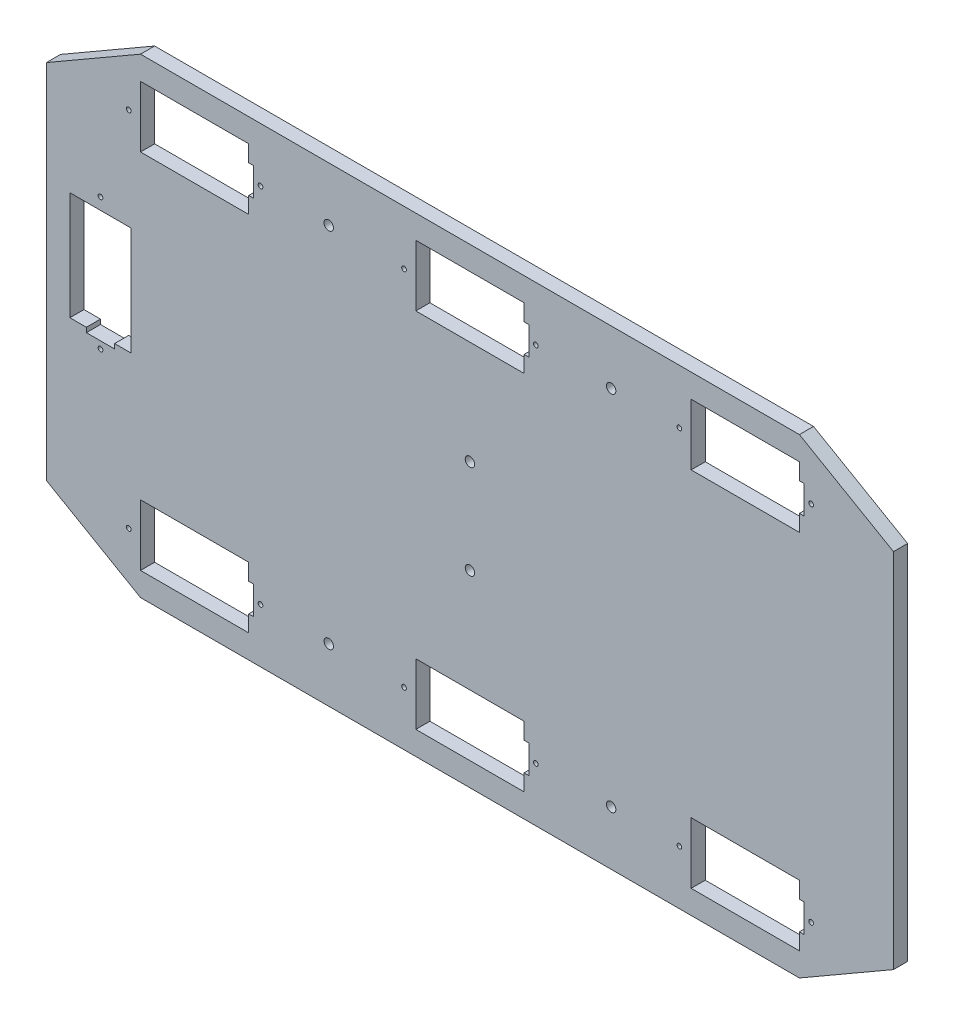
from build123d import *

# Parameters (mm, degrees)
BOSS_EXTRUDE1_DEPTH = 3
CUT_EXTRUDE1_REACH  = 105
SKETCH2_R           = 0.5
SKETCH2_R_2         = 1
CUT_EXTRUDE2_REACH  = 105
SKETCH3_R           = 0.5
CUT_EXTRUDE3_REACH  = 105
SKETCH5_R           = 1


with BuildPart() as part:
    # Sketch1 → Boss-Extrude1 (new body)
    with BuildSketch(Plane.XY):
        Polygon((70, 50), (90, 38.452994616), (90, -38.452994616), (70, -50), (-70, -50), (-90, -38.452994616), (-90, 38.452994616), (-70, 50), align=None)
    extrude(amount=BOSS_EXTRUDE1_DEPTH)

    # Sketch2 → Cut-Extrude1 (cut, up to next)
    with BuildSketch(Plane.XY.offset(3), mode=Mode.PRIVATE) as cut_extrude1_sk1:
        with Locations((-72.5, 38.5)):
            Circle(SKETCH2_R)
    cut_extrude1_tool1 = extrude(cut_extrude1_sk1.sketch, amount=-CUT_EXTRUDE1_REACH, mode=Mode.PRIVATE) & part.part
    # Sketch2 → Cut-Extrude1 (cut, up to next)
    with BuildSketch(Plane.XY.offset(3), mode=Mode.PRIVATE) as cut_extrude1_sk2:
        with Locations((-44.5, 38.5)):
            Circle(SKETCH2_R)
    cut_extrude1_tool2 = extrude(cut_extrude1_sk2.sketch, amount=-CUT_EXTRUDE1_REACH, mode=Mode.PRIVATE) & part.part
    # Sketch2 → Cut-Extrude1 (cut, up to next)
    with BuildSketch(Plane.XY.offset(3), mode=Mode.PRIVATE) as cut_extrude1_sk3:
        with Locations((-14, 38.5)):
            Circle(SKETCH2_R)
    cut_extrude1_tool3 = extrude(cut_extrude1_sk3.sketch, amount=-CUT_EXTRUDE1_REACH, mode=Mode.PRIVATE) & part.part
    # Sketch2 → Cut-Extrude1 (cut, up to next)
    with BuildSketch(Plane.XY.offset(3), mode=Mode.PRIVATE) as cut_extrude1_sk4:
        with Locations((14, 38.5)):
            Circle(SKETCH2_R)
    cut_extrude1_tool4 = extrude(cut_extrude1_sk4.sketch, amount=-CUT_EXTRUDE1_REACH, mode=Mode.PRIVATE) & part.part
    # Sketch2 → Cut-Extrude1 (cut, up to next)
    with BuildSketch(Plane.XY.offset(3), mode=Mode.PRIVATE) as cut_extrude1_sk5:
        with Locations((44.5, 38.5)):
            Circle(SKETCH2_R)
    cut_extrude1_tool5 = extrude(cut_extrude1_sk5.sketch, amount=-CUT_EXTRUDE1_REACH, mode=Mode.PRIVATE) & part.part
    # Sketch2 → Cut-Extrude1 (cut, up to next)
    with BuildSketch(Plane.XY.offset(3), mode=Mode.PRIVATE) as cut_extrude1_sk6:
        with Locations((72.5, 38.5)):
            Circle(SKETCH2_R)
    cut_extrude1_tool6 = extrude(cut_extrude1_sk6.sketch, amount=-CUT_EXTRUDE1_REACH, mode=Mode.PRIVATE) & part.part
    # Sketch2 → Cut-Extrude1 (cut, up to next)
    with BuildSketch(Plane.XY.offset(3), mode=Mode.PRIVATE) as cut_extrude1_sk7:
        with Locations((72.5, -38.5)):
            Circle(SKETCH2_R)
    cut_extrude1_tool7 = extrude(cut_extrude1_sk7.sketch, amount=-CUT_EXTRUDE1_REACH, mode=Mode.PRIVATE) & part.part
    # Sketch2 → Cut-Extrude1 (cut, up to next)
    with BuildSketch(Plane.XY.offset(3), mode=Mode.PRIVATE) as cut_extrude1_sk8:
        with Locations((44.5, -38.5)):
            Circle(SKETCH2_R)
    cut_extrude1_tool8 = extrude(cut_extrude1_sk8.sketch, amount=-CUT_EXTRUDE1_REACH, mode=Mode.PRIVATE) & part.part
    # Sketch2 → Cut-Extrude1 (cut, up to next)
    with BuildSketch(Plane.XY.offset(3), mode=Mode.PRIVATE) as cut_extrude1_sk9:
        with Locations((14, -38.5)):
            Circle(SKETCH2_R)
    cut_extrude1_tool9 = extrude(cut_extrude1_sk9.sketch, amount=-CUT_EXTRUDE1_REACH, mode=Mode.PRIVATE) & part.part
    # Sketch2 → Cut-Extrude1 (cut, up to next)
    with BuildSketch(Plane.XY.offset(3), mode=Mode.PRIVATE) as cut_extrude1_sk10:
        with Locations((-14, -38.5)):
            Circle(SKETCH2_R)
    cut_extrude1_tool10 = extrude(cut_extrude1_sk10.sketch, amount=-CUT_EXTRUDE1_REACH, mode=Mode.PRIVATE) & part.part
    # Sketch2 → Cut-Extrude1 (cut, up to next)
    with BuildSketch(Plane.XY.offset(3), mode=Mode.PRIVATE) as cut_extrude1_sk11:
        with Locations((-44.5, -38.5)):
            Circle(SKETCH2_R)
    cut_extrude1_tool11 = extrude(cut_extrude1_sk11.sketch, amount=-CUT_EXTRUDE1_REACH, mode=Mode.PRIVATE) & part.part
    # Sketch2 → Cut-Extrude1 (cut, up to next)
    with BuildSketch(Plane.XY.offset(3), mode=Mode.PRIVATE) as cut_extrude1_sk12:
        with Locations((-72.5, -38.5)):
            Circle(SKETCH2_R)
    cut_extrude1_tool12 = extrude(cut_extrude1_sk12.sketch, amount=-CUT_EXTRUDE1_REACH, mode=Mode.PRIVATE) & part.part
    # Sketch2 → Cut-Extrude1 (cut, up to next)
    with BuildSketch(Plane.XY.offset(3), mode=Mode.PRIVATE) as cut_extrude1_sk13:
        with Locations((0, 10)):
            Circle(SKETCH2_R_2)
    cut_extrude1_tool13 = extrude(cut_extrude1_sk13.sketch, amount=-CUT_EXTRUDE1_REACH, mode=Mode.PRIVATE) & part.part
    # Sketch2 → Cut-Extrude1 (cut, up to next)
    with BuildSketch(Plane.XY.offset(3), mode=Mode.PRIVATE) as cut_extrude1_sk14:
        with Locations((0, -10)):
            Circle(SKETCH2_R_2)
    cut_extrude1_tool14 = extrude(cut_extrude1_sk14.sketch, amount=-CUT_EXTRUDE1_REACH, mode=Mode.PRIVATE) & part.part
    # Sketch2 → Cut-Extrude1 (cut, up to next)
    with BuildSketch(Plane.XY.offset(3), mode=Mode.PRIVATE) as cut_extrude1_sk15:
        Polygon((-11.5, 45), (11.5, 45), (11.5, 41.5), (12.5, 41.5), (12.5, 35.5), (11.5, 35.5), (11.5, 32), (-11.5, 32), align=None)
    cut_extrude1_tool15 = extrude(cut_extrude1_sk15.sketch, amount=-CUT_EXTRUDE1_REACH, mode=Mode.PRIVATE) & part.part
    # Sketch2 → Cut-Extrude1 (cut, up to next)
    with BuildSketch(Plane.XY.offset(3), mode=Mode.PRIVATE) as cut_extrude1_sk16:
        Polygon((-11.5, -32), (11.5, -32), (11.5, -35.5), (12.5, -35.5), (12.5, -41.5), (11.5, -41.5), (11.5, -45), (-11.5, -45), align=None)
    cut_extrude1_tool16 = extrude(cut_extrude1_sk16.sketch, amount=-CUT_EXTRUDE1_REACH, mode=Mode.PRIVATE) & part.part
    # Sketch2 → Cut-Extrude1 (cut, up to next)
    with BuildSketch(Plane.XY.offset(3), mode=Mode.PRIVATE) as cut_extrude1_sk17:
        Polygon((-70, 45), (-47, 45), (-47, 41.5), (-46, 41.5), (-46, 35.5), (-47, 35.5), (-47, 32), (-70, 32), align=None)
    cut_extrude1_tool17 = extrude(cut_extrude1_sk17.sketch, amount=-CUT_EXTRUDE1_REACH, mode=Mode.PRIVATE) & part.part
    # Sketch2 → Cut-Extrude1 (cut, up to next)
    with BuildSketch(Plane.XY.offset(3), mode=Mode.PRIVATE) as cut_extrude1_sk18:
        Polygon((-70, -32), (-47, -32), (-47, -35.5), (-46, -35.5), (-46, -41.5), (-47, -41.5), (-47, -45), (-70, -45), align=None)
    cut_extrude1_tool18 = extrude(cut_extrude1_sk18.sketch, amount=-CUT_EXTRUDE1_REACH, mode=Mode.PRIVATE) & part.part
    # Sketch2 → Cut-Extrude1 (cut, up to next)
    with BuildSketch(Plane.XY.offset(3), mode=Mode.PRIVATE) as cut_extrude1_sk19:
        Polygon((70, -32), (47, -32), (47, -45), (70, -45), (70, -41.5), (71, -41.5), (71, -35.5), (70, -35.5), align=None)
    cut_extrude1_tool19 = extrude(cut_extrude1_sk19.sketch, amount=-CUT_EXTRUDE1_REACH, mode=Mode.PRIVATE) & part.part
    # Sketch2 → Cut-Extrude1 (cut, up to next)
    with BuildSketch(Plane.XY.offset(3), mode=Mode.PRIVATE) as cut_extrude1_sk20:
        Polygon((70, 45), (47, 45), (47, 32), (70, 32), (70, 35.5), (71, 35.5), (71, 41.5), (70, 41.5), align=None)
    cut_extrude1_tool20 = extrude(cut_extrude1_sk20.sketch, amount=-CUT_EXTRUDE1_REACH, mode=Mode.PRIVATE) & part.part
    add(cut_extrude1_tool1.solids().sort_by_distance((-72.5, 38.5, 3))[0], mode=Mode.SUBTRACT)
    add(cut_extrude1_tool2.solids().sort_by_distance((-44.5, 38.5, 3))[0], mode=Mode.SUBTRACT)
    add(cut_extrude1_tool3.solids().sort_by_distance((-14, 38.5, 3))[0], mode=Mode.SUBTRACT)
    add(cut_extrude1_tool4.solids().sort_by_distance((14, 38.5, 3))[0], mode=Mode.SUBTRACT)
    add(cut_extrude1_tool5.solids().sort_by_distance((44.5, 38.5, 3))[0], mode=Mode.SUBTRACT)
    add(cut_extrude1_tool6.solids().sort_by_distance((72.5, 38.5, 3))[0], mode=Mode.SUBTRACT)
    add(cut_extrude1_tool7.solids().sort_by_distance((72.5, -38.5, 3))[0], mode=Mode.SUBTRACT)
    add(cut_extrude1_tool8.solids().sort_by_distance((44.5, -38.5, 3))[0], mode=Mode.SUBTRACT)
    add(cut_extrude1_tool9.solids().sort_by_distance((14, -38.5, 3))[0], mode=Mode.SUBTRACT)
    add(cut_extrude1_tool10.solids().sort_by_distance((-14, -38.5, 3))[0], mode=Mode.SUBTRACT)
    add(cut_extrude1_tool11.solids().sort_by_distance((-44.5, -38.5, 3))[0], mode=Mode.SUBTRACT)
    add(cut_extrude1_tool12.solids().sort_by_distance((-72.5, -38.5, 3))[0], mode=Mode.SUBTRACT)
    add(cut_extrude1_tool13.solids().sort_by_distance((0, 10, 3))[0], mode=Mode.SUBTRACT)
    add(cut_extrude1_tool14.solids().sort_by_distance((0, -10, 3))[0], mode=Mode.SUBTRACT)
    add(cut_extrude1_tool15.solids().sort_by_distance((0.236066, 38.5, 3))[0], mode=Mode.SUBTRACT)
    add(cut_extrude1_tool16.solids().sort_by_distance((0.236066, -38.5, 3))[0], mode=Mode.SUBTRACT)
    add(cut_extrude1_tool17.solids().sort_by_distance((-58.263934, 38.5, 3))[0], mode=Mode.SUBTRACT)
    add(cut_extrude1_tool18.solids().sort_by_distance((-58.263934, -38.5, 3))[0], mode=Mode.SUBTRACT)
    add(cut_extrude1_tool19.solids().sort_by_distance((58.736066, -38.5, 3))[0], mode=Mode.SUBTRACT)
    add(cut_extrude1_tool20.solids().sort_by_distance((58.736066, 38.5, 3))[0], mode=Mode.SUBTRACT)

    # Sketch3 → Cut-Extrude2 (cut, up to next)
    with BuildSketch(Plane.XY.offset(3), mode=Mode.PRIVATE) as cut_extrude2_sk1:
        with Locations((-78.5, 19.5)):
            Circle(SKETCH3_R)
    cut_extrude2_tool1 = extrude(cut_extrude2_sk1.sketch, amount=-CUT_EXTRUDE2_REACH, mode=Mode.PRIVATE) & part.part
    # Sketch3 → Cut-Extrude2 (cut, up to next)
    with BuildSketch(Plane.XY.offset(3), mode=Mode.PRIVATE) as cut_extrude2_sk2:
        with Locations((-78.5, -8.5)):
            Circle(SKETCH3_R)
    cut_extrude2_tool2 = extrude(cut_extrude2_sk2.sketch, amount=-CUT_EXTRUDE2_REACH, mode=Mode.PRIVATE) & part.part
    # Sketch3 → Cut-Extrude2 (cut, up to next)
    with BuildSketch(Plane.XY.offset(3), mode=Mode.PRIVATE) as cut_extrude2_sk3:
        Polygon((-85, 17), (-72, 17), (-72, -6), (-75.5, -6), (-75.5, -7), (-81.5, -7), (-81.5, -6), (-85, -6), align=None)
    cut_extrude2_tool3 = extrude(cut_extrude2_sk3.sketch, amount=-CUT_EXTRUDE2_REACH, mode=Mode.PRIVATE) & part.part
    add(cut_extrude2_tool1.solids().sort_by_distance((-78.5, 19.5, 3))[0], mode=Mode.SUBTRACT)
    add(cut_extrude2_tool2.solids().sort_by_distance((-78.5, -8.5, 3))[0], mode=Mode.SUBTRACT)
    add(cut_extrude2_tool3.solids().sort_by_distance((-78.5, 5.263934, 3))[0], mode=Mode.SUBTRACT)

    # Sketch5 → Cut-Extrude3 (cut, up to next)
    with BuildSketch(Plane(origin=(0, 0, 0), x_dir=(-1, 0, 0), z_dir=(0, 0, -1)), mode=Mode.PRIVATE) as cut_extrude3_sk1:
        with Locations((30, 38.5)):
            Circle(SKETCH5_R)
    cut_extrude3_tool1 = extrude(cut_extrude3_sk1.sketch, amount=-CUT_EXTRUDE3_REACH, mode=Mode.PRIVATE) & part.part
    # Sketch5 → Cut-Extrude3 (cut, up to next)
    with BuildSketch(Plane(origin=(0, 0, 0), x_dir=(-1, 0, 0), z_dir=(0, 0, -1)), mode=Mode.PRIVATE) as cut_extrude3_sk2:
        with Locations((-30, 38.5)):
            Circle(SKETCH5_R)
    cut_extrude3_tool2 = extrude(cut_extrude3_sk2.sketch, amount=-CUT_EXTRUDE3_REACH, mode=Mode.PRIVATE) & part.part
    # Sketch5 → Cut-Extrude3 (cut, up to next)
    with BuildSketch(Plane(origin=(0, 0, 0), x_dir=(-1, 0, 0), z_dir=(0, 0, -1)), mode=Mode.PRIVATE) as cut_extrude3_sk3:
        with Locations((30, -38.5)):
            Circle(SKETCH5_R)
    cut_extrude3_tool3 = extrude(cut_extrude3_sk3.sketch, amount=-CUT_EXTRUDE3_REACH, mode=Mode.PRIVATE) & part.part
    # Sketch5 → Cut-Extrude3 (cut, up to next)
    with BuildSketch(Plane(origin=(0, 0, 0), x_dir=(-1, 0, 0), z_dir=(0, 0, -1)), mode=Mode.PRIVATE) as cut_extrude3_sk4:
        with Locations((-30, -38.5)):
            Circle(SKETCH5_R)
    cut_extrude3_tool4 = extrude(cut_extrude3_sk4.sketch, amount=-CUT_EXTRUDE3_REACH, mode=Mode.PRIVATE) & part.part
    add(cut_extrude3_tool1.solids().sort_by_distance((-30, 38.5, 0))[0], mode=Mode.SUBTRACT)
    add(cut_extrude3_tool2.solids().sort_by_distance((30, 38.5, 0))[0], mode=Mode.SUBTRACT)
    add(cut_extrude3_tool3.solids().sort_by_distance((-30, -38.5, 0))[0], mode=Mode.SUBTRACT)
    add(cut_extrude3_tool4.solids().sort_by_distance((30, -38.5, 0))[0], mode=Mode.SUBTRACT)


solid = part.part
